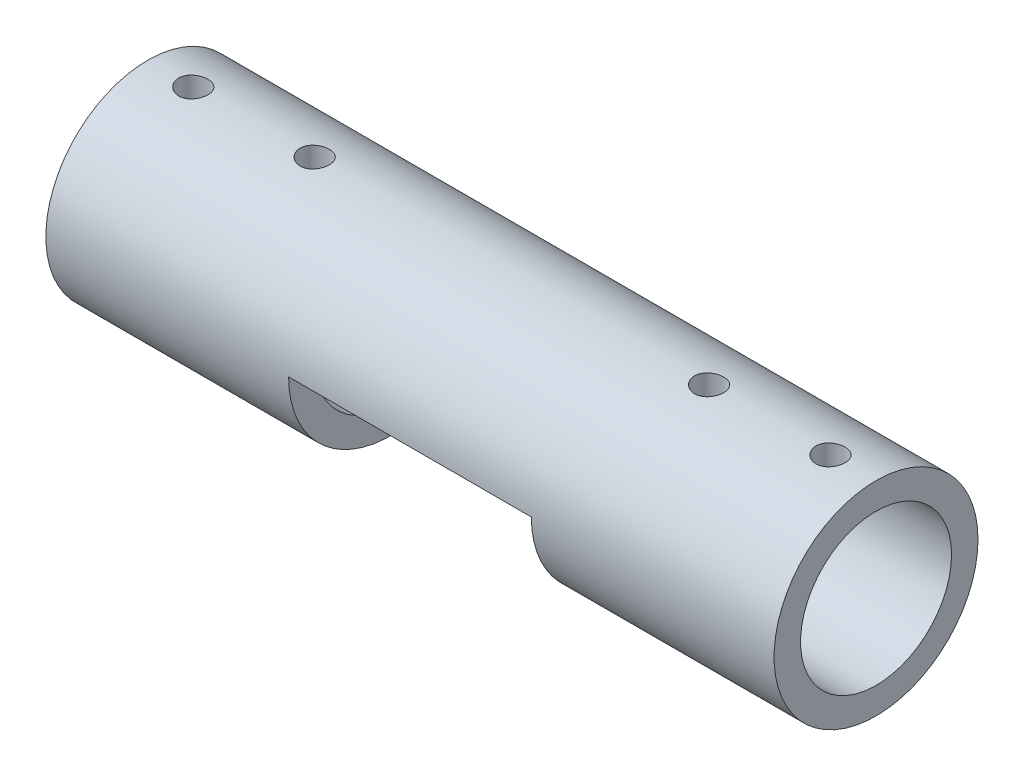
from build123d import *

# Parameters (mm, degrees)
SKETCH1_R               = 10.668
SKETCH1_R_2             = 7.8994
MAINBODY_DEPTH          = 76.2
COAXENTRY_REACH         = 79.679
SKETCH2_W               = 25.4
SKETCH2_H               = 25.4
SKETCH3_R               = 1.524
ANTENNAMOUNTHOLES_DEPTH = 78.679163538


with BuildPart() as part:
    # Sketch1 → MainBody (new body)
    with BuildSketch(Plane(origin=(0, 0, 0), x_dir=(0, 0, -1), z_dir=(1, 0, 0))):
        with Locations(Location((0, 0, 0), (0, 0, 180))):
            Circle(SKETCH1_R)
        with Locations(Location((0, 0, 0), (0, 0, 180))):
            Circle(SKETCH1_R_2, mode=Mode.SUBTRACT)
    extrude(amount=MAINBODY_DEPTH)

    # Sketch2 → CoaxEntry (cut, up to next)
    with BuildSketch(Plane(origin=(0, 0, 0), x_dir=(1, 0, 0), z_dir=(0, 1, 0)), mode=Mode.PRIVATE) as coaxentry_sk1:
        with Locations((38.1, 0)):
            Rectangle(SKETCH2_W, SKETCH2_H)
    coaxentry_tool1 = extrude(coaxentry_sk1.sketch, amount=-COAXENTRY_REACH, mode=Mode.PRIVATE) & part.part
    add(coaxentry_tool1.solids().sort_by_distance((38.1, 0, 0))[0], mode=Mode.SUBTRACT)

    # Sketch3 → AntennaMountHoles (cut, through all)
    with BuildSketch(Plane(origin=(0, 0, 0), x_dir=(1, 0, 0), z_dir=(0, 1, 0))):
        with Locations(Location((4.7625, 0, 0), (0, 0, 90))):
            Circle(SKETCH3_R)
        with Locations(Location((17.4625, 0, 0), (0, 0, 90))):
            Circle(SKETCH3_R)
        with Locations(Location((71.4375, 0, 0), (0, 0, 90))):
            Circle(SKETCH3_R)
        with Locations(Location((58.7375, 0, 0), (0, 0, 90))):
            Circle(SKETCH3_R)
    extrude(amount=ANTENNAMOUNTHOLES_DEPTH, mode=Mode.SUBTRACT)


solid = part.part
